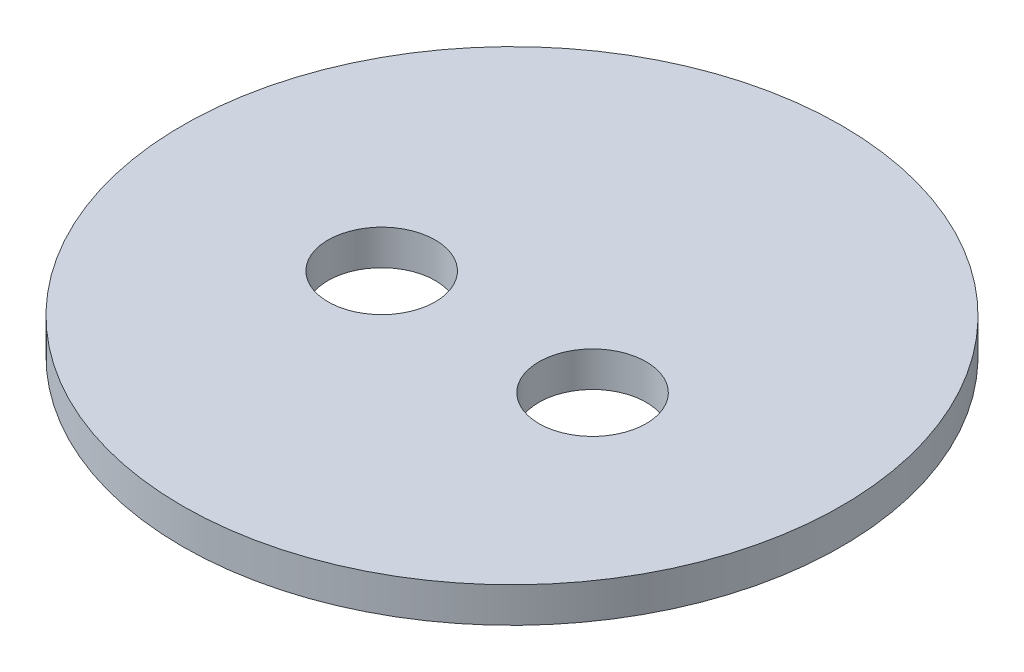
from build123d import *

# Parameters (mm, degrees)
SKETCH1_R           = 9.375
BOSS_EXTRUDE1_DEPTH = 1
SKETCH2_R           = 1.525
CUT_EXTRUDE1_DEPTH  = 14.295911026


with BuildPart() as part:
    # Sketch1 → Boss-Extrude1 (new body)
    with BuildSketch(Plane(origin=(0, 0, 0), x_dir=(1, 0, 0), z_dir=(0, 1, 0))):
        with Locations(Location((0, 0, 0), (0, 0, 270))):
            Circle(SKETCH1_R)
    extrude(amount=BOSS_EXTRUDE1_DEPTH)

    # Sketch2 → Cut-Extrude1 (cut, through all)
    with BuildSketch(Plane(origin=(0, 1, 0), x_dir=(1, 0, 0), z_dir=(0, 1, 0))):
        with Locations(Location((3.042080578, -0.75, 0), (0, 0, 270))):
            Circle(SKETCH2_R)
        with Locations(Location((-2.957919422, -0.75, 0), (0, 0, 90))):
            Circle(SKETCH2_R)
    extrude(amount=-CUT_EXTRUDE1_DEPTH, mode=Mode.SUBTRACT)


solid = part.part
